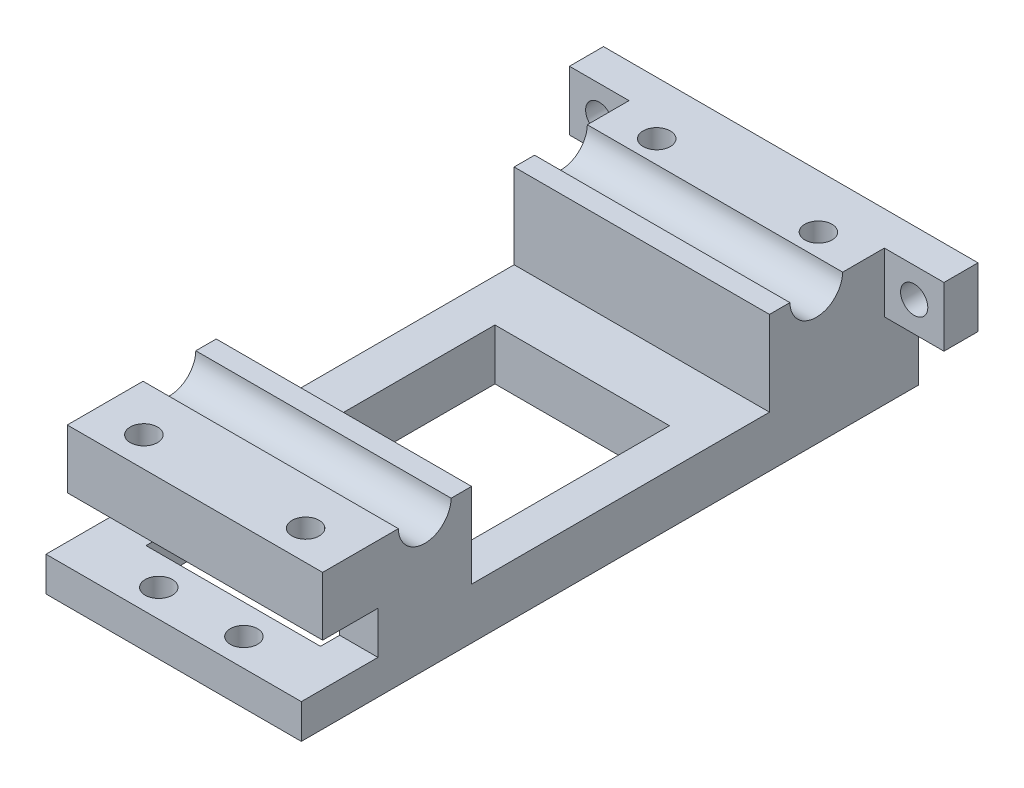
from build123d import *

# Parameters (mm, degrees)
SKETCH3_W           = 30
SKETCH3_H           = 72.5
BOSS_EXTRUDE2_DEPTH = 15.95
SKETCH7_W           = 20.5
SKETCH7_H           = 41
CUT_EXTRUDE5_DEPTH  = 8
SKETCH8_W           = 30
SKETCH8_H           = 35
CUT_EXTRUDE6_DEPTH  = 9.95
CUT_EXTRUDE7_DEPTH  = 50.683649222
SKETCH10_R          = 3.1
CUT_EXTRUDE8_DEPTH  = 50.683649222
CUT_EXTRUDE9_REACH  = 44.349
SKETCH11_R          = 1.6
CUT_EXTRUDE10_REACH = 42.996
SKETCH12_R          = 1.6
SKETCH13_W          = 7
SKETCH13_H          = 7
SKETCH13_R          = 1.6
BOSS_EXTRUDE3_DEPTH = 4


with BuildPart() as part:
    # Sketch3 → Boss-Extrude2 (new body)
    with BuildSketch(Plane(origin=(0, 0, 0), x_dir=(1, 0, 0), z_dir=(0, 1, 0))):
        Rectangle(SKETCH3_W, SKETCH3_H)
    extrude(amount=BOSS_EXTRUDE2_DEPTH)

    # Sketch7 → Cut-Extrude5 (cut)
    with BuildSketch(Plane.XZ):
        with Locations((0.25, 9)):
            Rectangle(SKETCH7_W, SKETCH7_H)
    extrude(amount=-CUT_EXTRUDE5_DEPTH, mode=Mode.SUBTRACT)

    # Sketch8 → Cut-Extrude6 (cut)
    with BuildSketch(Plane(origin=(0, 15.95, 0), x_dir=(1, 0, 0), z_dir=(0, 1, 0))):
        with Locations((0, 1.25)):
            Rectangle(SKETCH8_W, SKETCH8_H)
    extrude(amount=-CUT_EXTRUDE6_DEPTH, mode=Mode.SUBTRACT)

    # Sketch9 → Cut-Extrude7 (cut, through all)
    with BuildSketch(Plane(origin=(15, 0, 0), x_dir=(0, 0, -1), z_dir=(1, 0, 0))):
        Polygon((-36.25, 15.95), (-33.75, 15.95), (-33.75, 9.05), (-27.25, 9.05), (-27.25, 4.05), (-36.25, 4.05), align=None)
    extrude(amount=-CUT_EXTRUDE7_DEPTH, mode=Mode.SUBTRACT)

    # Sketch10 → Cut-Extrude8 (cut, through all)
    with BuildSketch(Plane(origin=(15, 0, 0), x_dir=(0, 0, -1), z_dir=(1, 0, 0))):
        with Locations((24.25, 16)):
            Circle(SKETCH10_R)
        with Locations((-21.75, 16)):
            Circle(SKETCH10_R)
    extrude(amount=-CUT_EXTRUDE8_DEPTH, mode=Mode.SUBTRACT)

    # Sketch11 → Cut-Extrude9 (cut, up to next)
    with BuildSketch(Plane(origin=(0, 15.95, 0), x_dir=(1, 0, 0), z_dir=(0, 1, 0)), mode=Mode.PRIVATE) as cut_extrude9_sk1:
        with Locations(Location((-9.5, -30.25, 0), (0, 0, 270))):
            Circle(SKETCH11_R)
    cut_extrude9_tool1 = extrude(cut_extrude9_sk1.sketch, amount=-CUT_EXTRUDE9_REACH, mode=Mode.PRIVATE) & part.part
    # Sketch11 → Cut-Extrude9 (cut, up to next)
    with BuildSketch(Plane(origin=(0, 15.95, 0), x_dir=(1, 0, 0), z_dir=(0, 1, 0)), mode=Mode.PRIVATE) as cut_extrude9_sk2:
        with Locations(Location((9.5, -30.25, 0), (0, 0, 270))):
            Circle(SKETCH11_R)
    cut_extrude9_tool2 = extrude(cut_extrude9_sk2.sketch, amount=-CUT_EXTRUDE9_REACH, mode=Mode.PRIVATE) & part.part
    # Sketch11 → Cut-Extrude9 (cut, up to next)
    with BuildSketch(Plane(origin=(0, 15.95, 0), x_dir=(1, 0, 0), z_dir=(0, 1, 0)), mode=Mode.PRIVATE) as cut_extrude9_sk3:
        with Locations(Location((-9.5, 30, 0), (0, 0, 270))):
            Circle(SKETCH11_R)
    cut_extrude9_tool3 = extrude(cut_extrude9_sk3.sketch, amount=-CUT_EXTRUDE9_REACH, mode=Mode.PRIVATE) & part.part
    # Sketch11 → Cut-Extrude9 (cut, up to next)
    with BuildSketch(Plane(origin=(0, 15.95, 0), x_dir=(1, 0, 0), z_dir=(0, 1, 0)), mode=Mode.PRIVATE) as cut_extrude9_sk4:
        with Locations(Location((9.5, 30, 0), (0, 0, 270))):
            Circle(SKETCH11_R)
    cut_extrude9_tool4 = extrude(cut_extrude9_sk4.sketch, amount=-CUT_EXTRUDE9_REACH, mode=Mode.PRIVATE) & part.part
    add(cut_extrude9_tool1.solids().sort_by_distance((-9.5, 15.95, 30.25))[0], mode=Mode.SUBTRACT)
    add(cut_extrude9_tool2.solids().sort_by_distance((9.5, 15.95, 30.25))[0], mode=Mode.SUBTRACT)
    add(cut_extrude9_tool3.solids().sort_by_distance((-9.5, 15.95, -30))[0], mode=Mode.SUBTRACT)
    add(cut_extrude9_tool4.solids().sort_by_distance((9.5, 15.95, -30))[0], mode=Mode.SUBTRACT)

    # Sketch12 → Cut-Extrude10 (cut, up to next)
    with BuildSketch(Plane(origin=(0, 4.05, 0), x_dir=(1, 0, 0), z_dir=(0, 1, 0)), mode=Mode.PRIVATE) as cut_extrude10_sk1:
        with Locations(Location((-5, -33, 0), (0, 0, 270))):
            Circle(SKETCH12_R)
    cut_extrude10_tool1 = extrude(cut_extrude10_sk1.sketch, amount=-CUT_EXTRUDE10_REACH, mode=Mode.PRIVATE) & part.part
    # Sketch12 → Cut-Extrude10 (cut, up to next)
    with BuildSketch(Plane(origin=(0, 4.05, 0), x_dir=(1, 0, 0), z_dir=(0, 1, 0)), mode=Mode.PRIVATE) as cut_extrude10_sk2:
        with Locations(Location((5, -33, 0), (0, 0, 270))):
            Circle(SKETCH12_R)
    cut_extrude10_tool2 = extrude(cut_extrude10_sk2.sketch, amount=-CUT_EXTRUDE10_REACH, mode=Mode.PRIVATE) & part.part
    # Sketch12 → Cut-Extrude10 (cut, up to next)
    with BuildSketch(Plane(origin=(0, 4.05, 0), x_dir=(1, 0, 0), z_dir=(0, 1, 0)), mode=Mode.PRIVATE) as cut_extrude10_sk3:
        with Locations(Location((-5, 15, 0), (0, 0, 270))):
            Circle(SKETCH12_R)
    cut_extrude10_tool3 = extrude(cut_extrude10_sk3.sketch, amount=-CUT_EXTRUDE10_REACH, mode=Mode.PRIVATE) & part.part
    # Sketch12 → Cut-Extrude10 (cut, up to next)
    with BuildSketch(Plane(origin=(0, 4.05, 0), x_dir=(1, 0, 0), z_dir=(0, 1, 0)), mode=Mode.PRIVATE) as cut_extrude10_sk4:
        with Locations(Location((5, 15, 0), (0, 0, 270))):
            Circle(SKETCH12_R)
    cut_extrude10_tool4 = extrude(cut_extrude10_sk4.sketch, amount=-CUT_EXTRUDE10_REACH, mode=Mode.PRIVATE) & part.part
    add(cut_extrude10_tool1.solids().sort_by_distance((-5, 4.05, 33))[0], mode=Mode.SUBTRACT)
    add(cut_extrude10_tool2.solids().sort_by_distance((5, 4.05, 33))[0], mode=Mode.SUBTRACT)
    add(cut_extrude10_tool3.solids().sort_by_distance((-5, 4.05, -15))[0], mode=Mode.SUBTRACT)
    add(cut_extrude10_tool4.solids().sort_by_distance((5, 4.05, -15))[0], mode=Mode.SUBTRACT)

    # Sketch13 → Boss-Extrude3 (add)
    # profile 1 of 2: a face of its own
    with BuildSketch(Plane(origin=(0, 0, -36.25), x_dir=(-1, 0, 0), z_dir=(0, 0, -1))):
        with Locations((18.5, 12.45)):
            Rectangle(SKETCH13_W, SKETCH13_H)
        with Locations((18.5, 12.45)):
            Circle(SKETCH13_R, mode=Mode.SUBTRACT)
    # profile 2 of 2: a face of its own
    with BuildSketch(Plane(origin=(0, 0, -36.25), x_dir=(-1, 0, 0), z_dir=(0, 0, -1))):
        with Locations((-18.5, 12.45)):
            Rectangle(SKETCH13_W, SKETCH13_H)
        with Locations((-18.5, 12.45)):
            Circle(SKETCH13_R, mode=Mode.SUBTRACT)
    extrude(amount=-BOSS_EXTRUDE3_DEPTH)


solid = part.part
